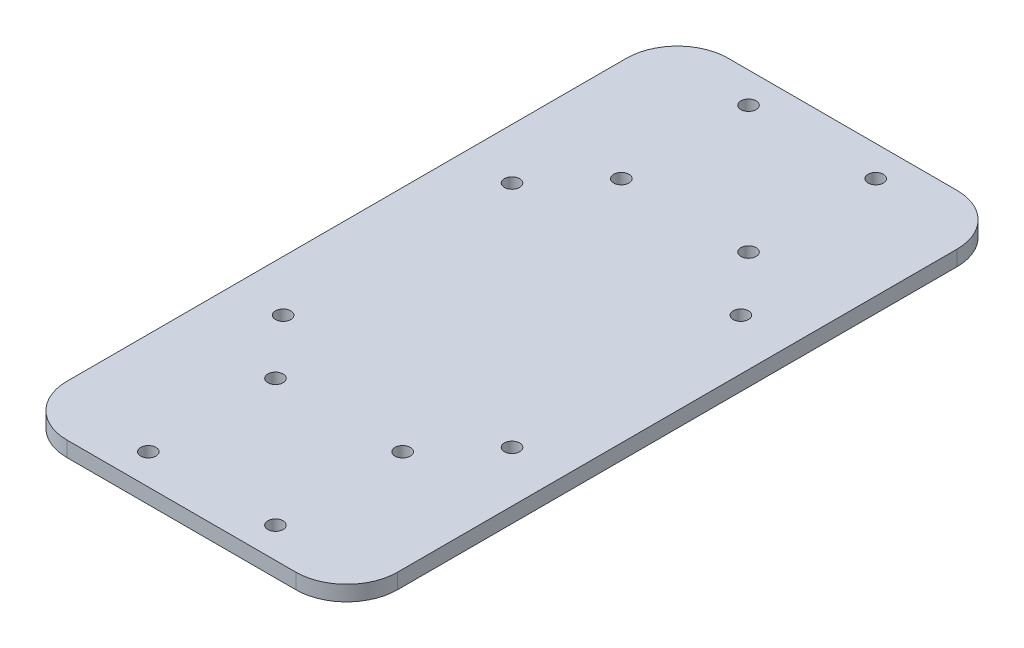
from build123d import *

# Parameters (mm, degrees)
SKETCH1_W           = 65
SKETCH1_H           = 130
SKETCH1_R           = 1.5
BOSS_EXTRUDE1_DEPTH = 3
SKETCH2_R           = 1.5
CUT_EXTRUDE2_DEPTH  = 73.734104793
FILLET1_R           = 10


with BuildPart() as part:
    # Sketch1 → Boss-Extrude1 (new body)
    with BuildSketch(Plane(origin=(0, 0, 0), x_dir=(1, 0, 0), z_dir=(0, 1, 0))):
        Rectangle(SKETCH1_W, SKETCH1_H)
        with Locations(Location((-22.5, 22.5, 0), (0, 0, 270))):
            Circle(SKETCH1_R, mode=Mode.SUBTRACT)
        with Locations(Location((22.5, 22.5, 0), (0, 0, 270))):
            Circle(SKETCH1_R, mode=Mode.SUBTRACT)
        with Locations(Location((-22.5, -22.5, 0), (0, 0, 90))):
            Circle(SKETCH1_R, mode=Mode.SUBTRACT)
        with Locations(Location((22.5, -22.5, 0), (0, 0, 90))):
            Circle(SKETCH1_R, mode=Mode.SUBTRACT)
    extrude(amount=BOSS_EXTRUDE1_DEPTH)

    # Sketch2 → Cut-Extrude2 (cut, through all)
    with BuildSketch(Plane(origin=(0, 0, 0), x_dir=(1, 0, 0), z_dir=(0, 1, 0))):
        with Locations(Location((-12.5, 59, 0), (0, 0, 270))):
            Circle(SKETCH2_R)
        with Locations(Location((12.5, 59, 0), (0, 0, 270))):
            Circle(SKETCH2_R)
        with Locations(Location((12.5, 34, 0), (0, 0, 270))):
            Circle(SKETCH2_R)
        with Locations(Location((-12.5, 34, 0), (0, 0, 270))):
            Circle(SKETCH2_R)
    cut_extrude2 = extrude(amount=CUT_EXTRUDE2_DEPTH, mode=Mode.SUBTRACT)

    # Mirror1: Cut-Extrude2 across plane
    add(cut_extrude2.mirror(Plane.XY), mode=Mode.SUBTRACT)

    # Fillet1
    fillet1_edges = [part.edges().sort_by_distance(p)[0] for p in [
        (32.5, 1.5, -65),
        (32.5, 1.5, 65),
        (-32.5, 1.5, 65),
        (-32.5, 1.5, -65),
    ]]
    fillet(fillet1_edges, radius=FILLET1_R)


solid = part.part
